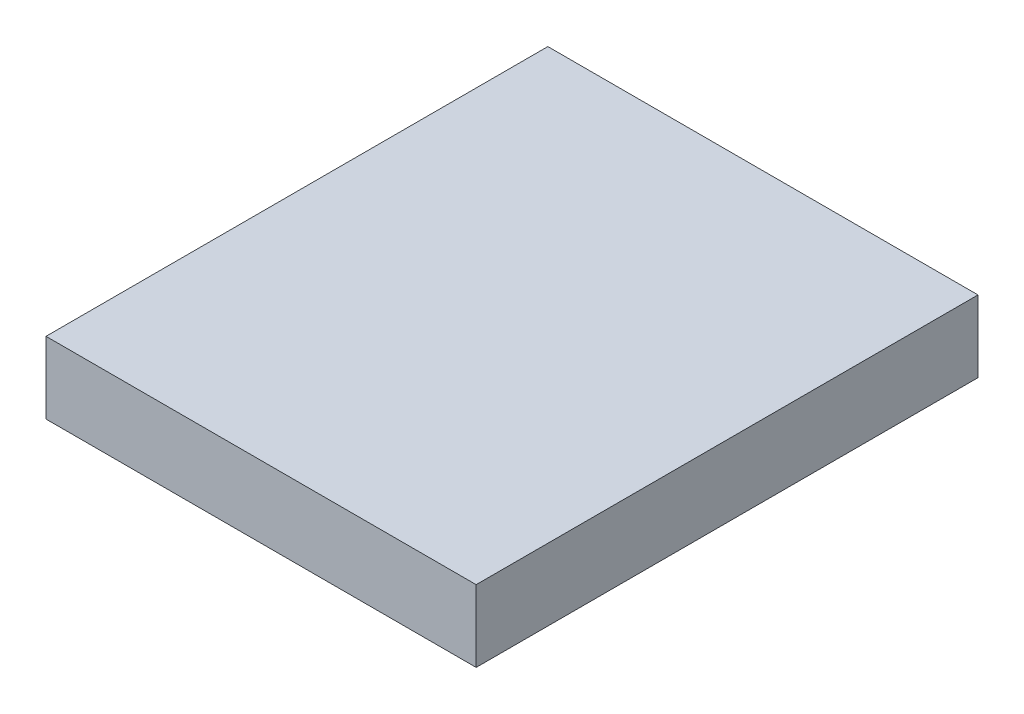
from build123d import *

# Parameters (mm, degrees)
SKETCH1_W           = 30
SKETCH1_H           = 35
BOSS_EXTRUDE1_DEPTH = 5


with BuildPart() as part:
    # Sketch1 → Boss-Extrude1 (new body)
    with BuildSketch(Plane(origin=(0, 0, 0), x_dir=(1, 0, 0), z_dir=(0, 1, 0))):
        Rectangle(SKETCH1_W, SKETCH1_H)
    extrude(amount=BOSS_EXTRUDE1_DEPTH)


solid = part.part
